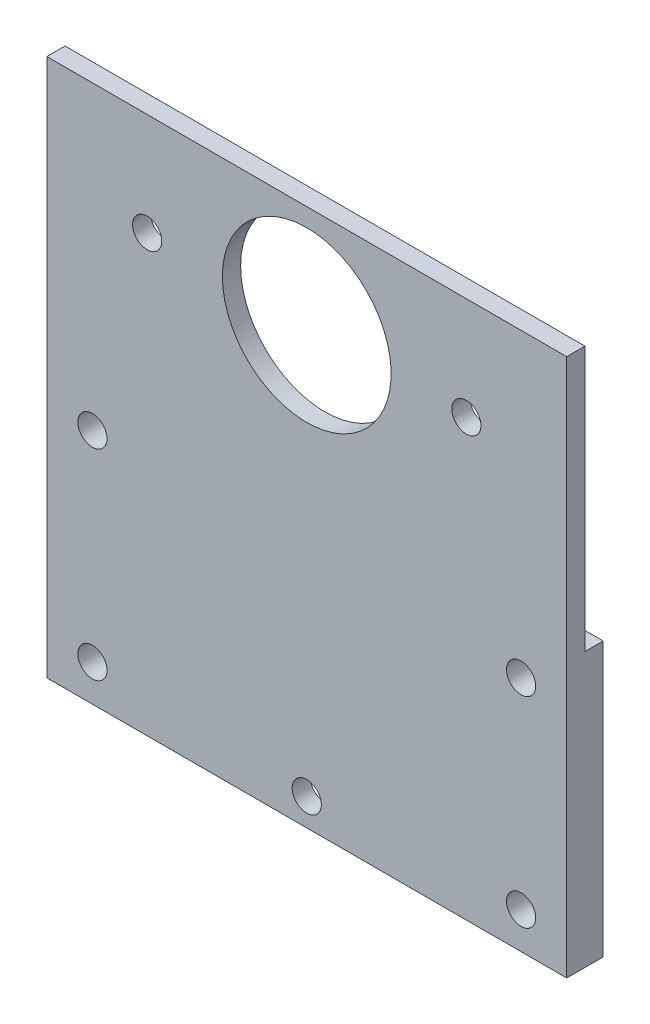
from build123d import *

# Parameters (mm, degrees)
SKIZZE1_W                      = 57
SKIZZE1_H                      = 59
GRUNDK_RPER_DEPTH              = 2
SKIZZE2_R                      = 9.25
SKIZZE2_R_2                    = 1.6
BOHRUNGEN_KUGELROLLER_DEPTH    = 66.553413336
SKIZZE3_W                      = 10
SKIZZE3_H                      = 30
AUFSATZ_GETRIEBEHALTER_DEPTH   = 2
SKIZZE4_R                      = 1.6
BOHRUNGEN_GETRIEBEHALTER_DEPTH = 66.644877942
SKIZZE5_R                      = 1.6
BOHRUNG_HALTERUNG_DEPTH        = 66.553413336


with BuildPart() as part:
    # Skizze1 → Grundkörper (new body)
    with BuildSketch(Plane.XY):
        with Locations((0, 29.5)):
            Rectangle(SKIZZE1_W, SKIZZE1_H)
    extrude(amount=GRUNDK_RPER_DEPTH)

    # Skizze2 → Bohrungen_Kugelroller (cut, through all)
    with BuildSketch(Plane(origin=(0, 0, 0), x_dir=(-1, 0, 0), z_dir=(0, 0, -1))):
        with Locations((0, 47.75)):
            Circle(SKIZZE2_R)
        with Locations((-17.5, 47.75)):
            Circle(SKIZZE2_R_2)
        with Locations(Location((17.5, 47.75, 0), (0, 0, 180))):
            Circle(SKIZZE2_R_2)
    extrude(amount=-BOHRUNGEN_KUGELROLLER_DEPTH, mode=Mode.SUBTRACT)

    # Skizze3 → Aufsatz_Getriebehalter (add)
    with BuildSketch(Plane(origin=(0, 0, 0), x_dir=(-1, 0, 0), z_dir=(0, 0, -1))):
        with Locations((-23.5, 15)):
            Rectangle(SKIZZE3_W, SKIZZE3_H)
        with Locations((23.5, 15)):
            Rectangle(SKIZZE3_W, SKIZZE3_H)
    extrude(amount=AUFSATZ_GETRIEBEHALTER_DEPTH)

    # Skizze4 → Bohrungen_Getriebehalter (cut, through all)
    with BuildSketch(Plane(origin=(0, 0, -2), x_dir=(-1, 0, 0), z_dir=(0, 0, -1))):
        with Locations((-23.5, 26)):
            Circle(SKIZZE4_R)
        with Locations(Location((23.5, 26, 0), (0, 0, 180))):
            Circle(SKIZZE4_R)
        with Locations((23.5, 4)):
            Circle(SKIZZE4_R)
        with Locations(Location((-23.5, 4, 0), (0, 0, 180))):
            Circle(SKIZZE4_R)
    extrude(amount=-BOHRUNGEN_GETRIEBEHALTER_DEPTH, mode=Mode.SUBTRACT)

    # Skizze5 → Bohrung_Halterung (cut, through all)
    with BuildSketch(Plane(origin=(0, 0, 0), x_dir=(-1, 0, 0), z_dir=(0, 0, -1))):
        with Locations((0, 3)):
            Circle(SKIZZE5_R)
    extrude(amount=-BOHRUNG_HALTERUNG_DEPTH, mode=Mode.SUBTRACT)


solid = part.part
